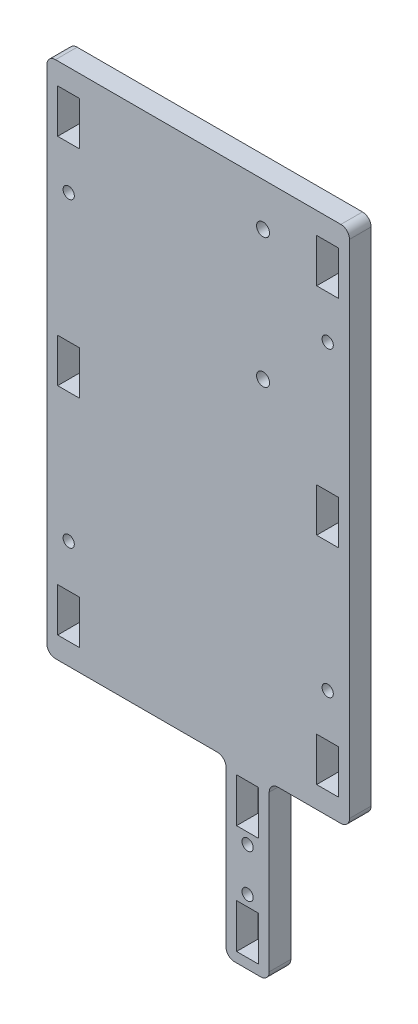
from build123d import *

# Parameters (mm, degrees)
SKETCH1_W           = 88.9
SKETCH1_H           = 152.4
SKETCH1_W_2         = 12.7
SKETCH1_H_2         = 50.8
SKETCH1_W_3         = 6.477
SKETCH1_H_3         = 12.954
BOSS_EXTRUDE1_DEPTH = 6.35
SKETCH3_W           = 6.477
SKETCH3_H           = 12.827
SKETCH3_R           = 1.651
CUT_EXTRUDE3_DEPTH  = 6.35
SKETCH4_R           = 1.651
CUT_EXTRUDE4_DEPTH  = 6.35
FILLET1_R           = 2.54
SKETCH5_R           = 1.905
CUT_EXTRUDE5_DEPTH  = 6.35


with BuildPart() as part:
    # Sketch1 → Boss-Extrude1 (new body)
    # profile 1 of 2: a face of its own
    with BuildSketch(Plane.XY):
        with Locations((44.45, 76.2)):
            Rectangle(SKETCH1_W, SKETCH1_H)
    # profile 2 of 2: a face of its own
    with BuildSketch(Plane.XY):
        with Locations((58.963500056, -25.4)):
            Rectangle(SKETCH1_W_2, SKETCH1_H_2)
        with Locations((58.963500056, -41.402)):
            Rectangle(SKETCH1_W_3, SKETCH1_H_3, mode=Mode.SUBTRACT)
        with Locations((58.963500056, -9.398)):
            Rectangle(SKETCH1_W_3, SKETCH1_H_3, mode=Mode.SUBTRACT)
    extrude(amount=BOSS_EXTRUDE1_DEPTH)

    # Sketch3 → Cut-Extrude3 (cut)
    with BuildSketch(Plane.XY.offset(6.35)):
        with Locations((6.4135, 139.6365)):
            Rectangle(SKETCH3_W, SKETCH3_H)
        with Locations((6.4135, 12.7635)):
            Rectangle(SKETCH3_W, SKETCH3_H)
        with Locations((82.4865, 139.6365)):
            Rectangle(SKETCH3_W, SKETCH3_H)
        with Locations((6.4135, 120.523)):
            Circle(SKETCH3_R)
        with Locations((6.4135, 76.2)):
            Rectangle(SKETCH3_W, SKETCH3_H)
        with Locations((6.4135, 31.877)):
            Circle(SKETCH3_R)
        with Locations((82.4865, 12.7635)):
            Rectangle(SKETCH3_W, SKETCH3_H)
        with Locations(Location((82.4865, 31.877, 0), (0, 0, 180))):
            Circle(SKETCH3_R)
        with Locations(Location((82.4865, 120.523, 0), (0, 0, 180))):
            Circle(SKETCH3_R)
        with Locations((82.4865, 76.2)):
            Rectangle(SKETCH3_W, SKETCH3_H)
    extrude(amount=-CUT_EXTRUDE3_DEPTH, mode=Mode.SUBTRACT)

    # Sketch4 → Cut-Extrude4 (cut)
    with BuildSketch(Plane.XY.offset(6.35)):
        with Locations((58.963500056, -19.05)):
            Circle(SKETCH4_R)
        with Locations((58.963500056, -31.75)):
            Circle(SKETCH4_R)
    extrude(amount=-CUT_EXTRUDE4_DEPTH, mode=Mode.SUBTRACT)

    # Fillet1
    fillet1_edges = [part.edges().sort_by_distance(p)[0] for p in [
        (0, 0, 3.175),
        (0, 152.4, 3.175),
        (88.9, 152.4, 3.175),
        (88.9, 0, 3.175),
        (65.313500056, 0, 3.175),
        (65.313500056, -50.8, 3.175),
        (52.613500056, -50.8, 3.175),
        (52.613500056, 0, 3.175),
    ]]
    fillet(fillet1_edges, radius=FILLET1_R)

    # Sketch5 → Cut-Extrude5 (cut)
    with BuildSketch(Plane.XY.offset(6.35)):
        with Locations((63.5, 139.7)):
            Circle(SKETCH5_R)
        with Locations((63.5, 101.6)):
            Circle(SKETCH5_R)
    extrude(amount=-CUT_EXTRUDE5_DEPTH, mode=Mode.SUBTRACT)


solid = part.part
